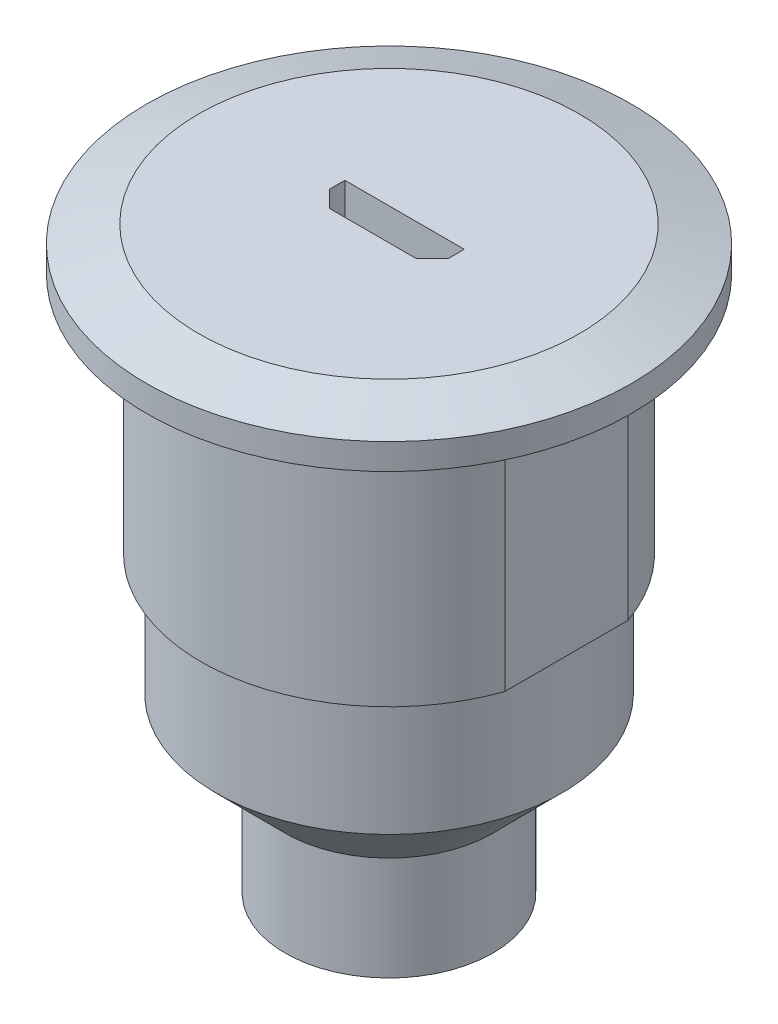
from build123d import *

# Parameters (mm, degrees)
ENL_V_MAT_EXTRU_1_DEPTH = 5
ENL_V_MAT_EXTRU_2_REACH = 45.997
ESQUISSE3_W             = 0.6
ESQUISSE3_H             = 14


with BuildPart() as part:
    # Esquisse1 → Révolution1 (revolve)
    with BuildSketch(Plane.XY):
        Polygon((0, 33.5), (-11, 33.5), (-14, 32.5), (-14, 31), (-10.85, 31), (-10.85, 17), (-9.985, 17), (-9.985, 10), (-6, 6), (-6, 0), (0, 0), align=None)
    revolve(axis=Axis((0, 33.5, 0), (0, -1, 0)))

    # Esquisse2 → Enlèv. mat.-Extru.1 (cut)
    with BuildSketch(Plane(origin=(0, 33.5, 0), x_dir=(1, 0, 0), z_dir=(0, 1, 0))):
        Polygon((-3.45, 0.9), (3.45, 0.9), (3.45, 0), (2.5, -0.95), (-2.5, -0.95), (-3.45, 0), align=None)
    extrude(amount=-ENL_V_MAT_EXTRU_1_DEPTH, mode=Mode.SUBTRACT)

    # Esquisse3 → Enlèv. mat.-Extru.2 (cut, up to next)
    with BuildSketch(Plane(origin=(0, 0, -10.85), x_dir=(-1, 0, 0), z_dir=(0, 0, -1)), mode=Mode.PRIVATE) as enl_v_mat_extru_2_sk1:
        with Locations((10.55, 24)):
            Rectangle(ESQUISSE3_W, ESQUISSE3_H)
    enl_v_mat_extru_2_tool1 = extrude(enl_v_mat_extru_2_sk1.sketch, amount=-ENL_V_MAT_EXTRU_2_REACH, mode=Mode.PRIVATE) & part.part
    # Esquisse3 → Enlèv. mat.-Extru.2 (cut, up to next)
    with BuildSketch(Plane(origin=(0, 0, -10.85), x_dir=(-1, 0, 0), z_dir=(0, 0, -1)), mode=Mode.PRIVATE) as enl_v_mat_extru_2_sk2:
        with Locations((-10.55, 24)):
            Rectangle(ESQUISSE3_W, ESQUISSE3_H)
    enl_v_mat_extru_2_tool2 = extrude(enl_v_mat_extru_2_sk2.sketch, amount=-ENL_V_MAT_EXTRU_2_REACH, mode=Mode.PRIVATE) & part.part
    add(enl_v_mat_extru_2_tool1.solids().sort_by_distance((-10.55, 24, -10.85))[0], mode=Mode.SUBTRACT)
    add(enl_v_mat_extru_2_tool2.solids().sort_by_distance((10.55, 24, -10.85))[0], mode=Mode.SUBTRACT)


solid = part.part
